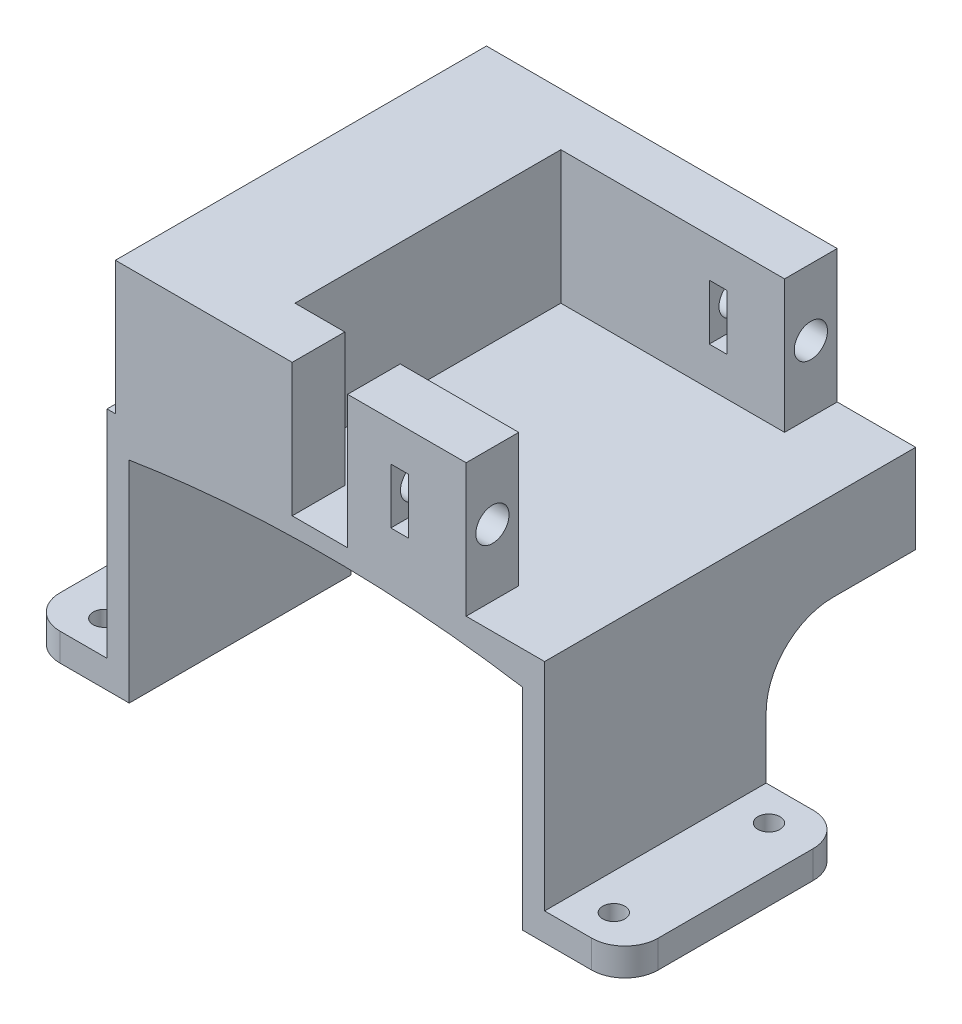
from build123d import *

# Parameters (mm, degrees)
BOSS_EXTRUDE1_DEPTH      = 33.5
SKETCH2_W                = 20
SKETCH2_H                = 2.5
BOSS_EXTRUDE2_DEPTH      = 8
CUT_EXTRUDE5_DEPTH       = 12
RESSALTO_EXTRUS_O4_DEPTH = 0.75
SKETCH6_R                = 1.5
CUT_EXTRUDE6_DEPTH       = 12
CUT_EXTRUDE8_REACH       = 49.447
SKETCH14_W               = 1.6
SKETCH14_H               = 5
SKETCH9_R                = 1
CORTE_EXTRUS_O1_DEPTH    = 54.324478432
FILETE1_R                = 3
ESBO_O6_R                = 1
CORTE_EXTRUS_O6_DEPTH    = 2
ESBO_O8_W                = 0.75
ESBO_O8_H                = 19
ESBO_O8_H_2              = 14
CORTE_EXTRUS_O8_DEPTH    = 48.44733923
FILETE1_OF_ESPELHAR1_R   = 3
CORTE_EXTRUS_O9_DEPTH    = 48.44733923
CORTE_EXTRUS_O10_DEPTH   = 61.891809882


with BuildPart() as part:
    # Sketch1 → Boss-Extrude1 (new body)
    with BuildSketch(Plane.XY):
        Polygon((17, -20), (19, -20), (19, 14), (-19, 14), (-19, -20), (-17, -20), (-17, -1), (17, -1), align=None)
    extrude(amount=BOSS_EXTRUDE1_DEPTH)

    # Sketch2 → Boss-Extrude2 (add)
    with BuildSketch(Plane(origin=(19, 0, 0), x_dir=(0, 0, -1), z_dir=(1, 0, 0))):
        with Locations((-23.5, -18.75)):
            Rectangle(SKETCH2_W, SKETCH2_H)
    boss_extrude2 = extrude(amount=BOSS_EXTRUDE2_DEPTH)

    # Sketch12 → Cut-Extrude5 (cut)
    with BuildSketch(Plane(origin=(0, 14, 0), x_dir=(1, 0, 0), z_dir=(0, 1, 0))):
        Polygon((-7.535857559, -4.75), (-7.535857559, -28.75), (-3.035857559, -28.75), (-3.035857559, -33.5), (1.964142441, -33.5), (1.964142441, -28.75), (12.664142441, -28.75), (12.664142441, -33.5), (19, -33.5), (19, 0), (12.664142441, 0), (12.664142441, -4.75), align=None)
    extrude(amount=-CUT_EXTRUDE5_DEPTH, mode=Mode.SUBTRACT)

    # Esboço10 → Ressalto-extrusão4 (add)
    with BuildSketch(Plane(origin=(19, 0, 0), x_dir=(0, 0, -1), z_dir=(1, 0, 0))):
        Polygon((-33.5, 2), (0, 2), (0, -17.5), (0, -20), (-13.5, -20), (-13.5, -17.5), (-33.5, -17.5), align=None)
    ressalto_extrus_o4 = extrude(amount=RESSALTO_EXTRUS_O4_DEPTH)

    # Sketch6 → Cut-Extrude6 (cut)
    with BuildSketch(Plane(origin=(12.664142441, 0, 0), x_dir=(0, 0, -1), z_dir=(1, 0, 0))):
        with Locations((-31.125, 8)):
            Circle(SKETCH6_R)
    cut_extrude6 = extrude(amount=-CUT_EXTRUDE6_DEPTH, mode=Mode.SUBTRACT)

    # Sketch14 → Cut-Extrude8 (cut, up to next)
    with BuildSketch(Plane.XY.offset(33.5), mode=Mode.PRIVATE) as cut_extrude8_sk1:
        with Locations((6.664142441, 8)):
            Rectangle(SKETCH14_W, SKETCH14_H)
    cut_extrude8_tool1 = extrude(cut_extrude8_sk1.sketch, amount=-CUT_EXTRUDE8_REACH, mode=Mode.PRIVATE) & part.part
    cut_extrude8 = cut_extrude8_tool1.solids().sort_by_distance((6.664142, 8, 33.5))[0]
    add(cut_extrude8, mode=Mode.SUBTRACT)

    # Mirror6: Cut-Extrude6, Cut-Extrude8 across plane
    add(cut_extrude6.mirror(Plane.XY.offset(16.75)), mode=Mode.SUBTRACT)
    add(cut_extrude8.mirror(Plane.XY.offset(16.75)), mode=Mode.SUBTRACT)

    # Sketch9 → Corte-extrusão1 (cut, through all)
    with BuildSketch(Plane(origin=(0, -17.5, 0), x_dir=(1, 0, 0), z_dir=(0, 1, 0))):
        with Locations(Location((23, -16.5, 0), (0, 0, 270))):
            Circle(SKETCH9_R)
        with Locations(Location((23, -30.5, 0), (0, 0, 270))):
            Circle(SKETCH9_R)
    corte_extrus_o1 = extrude(amount=-CORTE_EXTRUS_O1_DEPTH, mode=Mode.SUBTRACT)

    # Filete1
    filete1_edges = [part.edges().sort_by_distance(p)[0] for p in [
        (27, -18.75, 13.5),
        (27, -18.75, 33.5),
    ]]
    fillet(filete1_edges, radius=FILETE1_R)

    # Esboço6 → Corte-extrusão6 (cut)
    with BuildSketch(Plane.ZY.offset(19)):
        with Locations((22.25, 8)):
            Circle(ESBO_O6_R)
    extrude(amount=-CORTE_EXTRUS_O6_DEPTH, mode=Mode.SUBTRACT)

    # Esboço8 → Corte-extrusão8 (cut, through all)
    with BuildSketch(Plane.XY.offset(33.5)):
        with Locations((17.375, -10.5)):
            Rectangle(ESBO_O8_W, ESBO_O8_H)
        with Locations((-17.375, -8)):
            Rectangle(ESBO_O8_W, ESBO_O8_H_2)
    corte_extrus_o8 = extrude(amount=-CORTE_EXTRUS_O8_DEPTH, mode=Mode.SUBTRACT)

    # Espelhar1: Boss-Extrude2, Ressalto-extrusão4, Corte-extrusão1, Corte-extrusão8 across plane
    add(boss_extrude2.mirror(Plane(origin=(0, 0, 0), x_dir=(0, 0, 1), z_dir=(1, 0, 0))))
    add(ressalto_extrus_o4.mirror(Plane(origin=(0, 0, 0), x_dir=(0, 0, 1), z_dir=(1, 0, 0))))
    add(corte_extrus_o1.mirror(Plane(origin=(0, 0, 0), x_dir=(0, 0, 1), z_dir=(1, 0, 0))), mode=Mode.SUBTRACT)
    add(corte_extrus_o8.mirror(Plane(origin=(0, 0, 0), x_dir=(0, 0, 1), z_dir=(1, 0, 0))), mode=Mode.SUBTRACT)

    # Filete1 of Espelhar1
    filete1_of_espelhar1_edges = [part.edges().sort_by_distance(p)[0] for p in [
        (-27, -18.75, 13.5),
        (-27, -18.75, 33.5),
    ]]
    fillet(filete1_of_espelhar1_edges, radius=FILETE1_OF_ESPELHAR1_R)

    # Esboço11 → Corte-extrusão9 (cut, through all)
    with BuildSketch(Plane.XY.offset(33.5)):
        with BuildLine():
            Line((-17.75, -1), (17.75, -1))
            add(Edge.make_bspline(
                [(-17.75, -1), (0, 1.838465609), (17.75, -1)],
                knots=[0, 0, 0, 1, 1, 1], degree=2))
        make_face()
    extrude(amount=-CORTE_EXTRUS_O9_DEPTH, mode=Mode.SUBTRACT)

    # Esboço12 → Corte-extrusão10 (cut, through all)
    with BuildSketch(Plane(origin=(19.75, 0, 0), x_dir=(0, 0, -1), z_dir=(1, 0, 0))):
        with BuildLine():
            Line((0, -20), (-13.5, -20))
            Line((-13.5, -20), (-13.5, -12))
            ThreePointArc((-13.5, -12), (-11.742640687, -7.757359313), (-7.5, -6))
            Line((-7.5, -6), (0, -6))
            Line((0, -6), (0, -20))
        make_face()
    extrude(amount=-CORTE_EXTRUS_O10_DEPTH, mode=Mode.SUBTRACT)


solid = part.part
